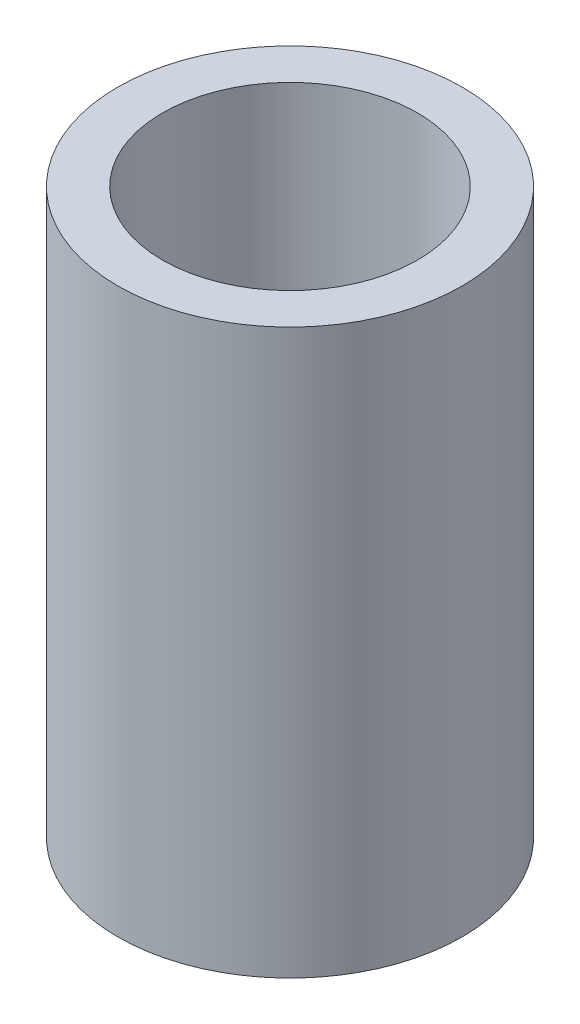
from build123d import *

# Parameters (mm, degrees)
SKETCH1_R           = 10.668
SKETCH1_R_2         = 7.8994
BOSS_EXTRUDE1_DEPTH = 34.925


with BuildPart() as part:
    # Sketch1 → Boss-Extrude1 (new body)
    with BuildSketch(Plane(origin=(0, 0, 0), x_dir=(1, 0, 0), z_dir=(0, 1, 0))):
        with Locations(Location((0, 0, 0), (0, 0, 270))):
            Circle(SKETCH1_R)
        with Locations(Location((0, 0, 0), (0, 0, 270))):
            Circle(SKETCH1_R_2, mode=Mode.SUBTRACT)
    extrude(amount=BOSS_EXTRUDE1_DEPTH)


solid = part.part
